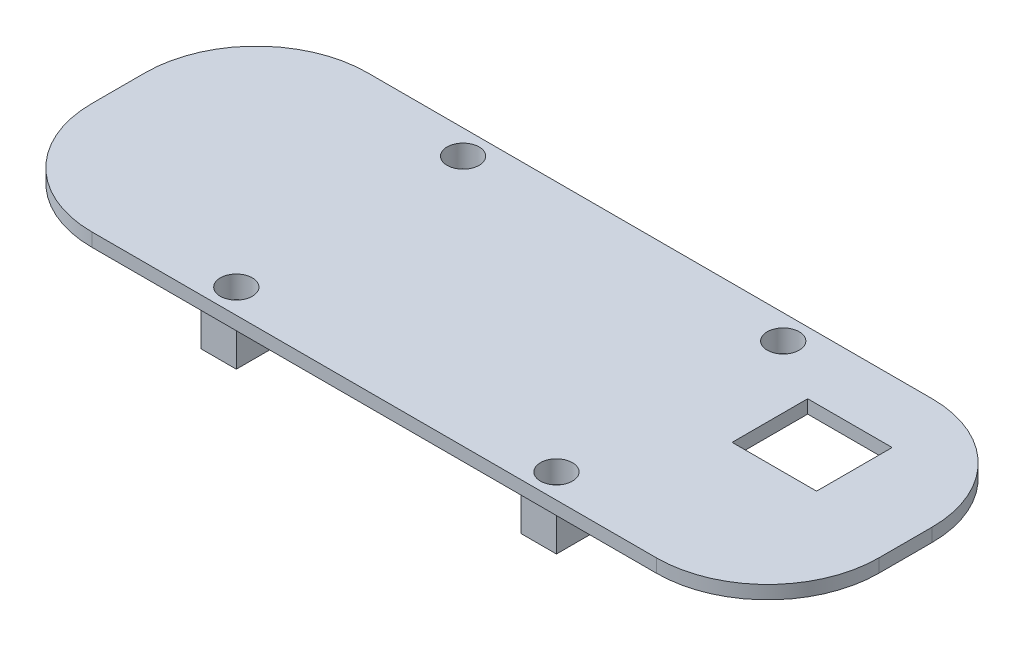
from build123d import *

# Parameters (mm, degrees)
SKETCH1_W                = 177
SKETCH1_H                = 62
BOSS_EXTRUDE1_DEPTH      = 70
FILLET1_R                = 25
SKETCH3_W                = 19
SKETCH3_H                = 17
CUT_EXTRUDE1_DEPTH       = 70
CUT_EXTRUDE5_DEPTH       = 64
BOSS_EXTRUDE7_DEPTH      = 33
SKETCH16_W               = 5
SKETCH16_H               = 5
BOSS_EXTRUDE8_DEPTH      = 40
SKETCH11_R               = 25
CUT_EXTRUDE9_DEPTH       = 5.5
SKETCH22_R               = 28.5
BOSS_EXTRUDE20_DEPTH     = 21
BOSS_EXTRUDE21_DEPTH     = 10
BOSS_EXTRUDE22_DEPTH     = 40
SKETCH26_R               = 25
SKETCH26_W               = 19
SKETCH26_H               = 17
BOSS_EXTRUDE23_DEPTH     = 1
SKETCH27_W               = 40
SKETCH27_H               = 10
CUT_EXTRUDE12_DEPTH      = 10
SKETCH28_W               = 10
SKETCH28_H               = 10
CUT_EXTRUDE13_DEPTH      = 5
SKETCH30_W               = 194.337314874
SKETCH30_H               = 68.122542634
CUT_EXTRUDE14_DEPTH      = 0.1
CUT_EXTRUDE17_DEPTH      = 58
CUT_EXTRUDE17_DEPTH_BACK = 45
SKETCH26_3_R             = 25
SKETCH26_3_W             = 19
SKETCH26_3_H             = 17
CUT_EXTRUDE25_START      = -21.9
CUT_EXTRUDE25_DEPTH      = 21.9
SKETCH38_W               = 8
SKETCH38_H               = 8
BOSS_EXTRUDE26_DEPTH     = 12
SKETCH41_R               = 3.6
CUT_EXTRUDE28_DEPTH      = 5
SKETCH44_R               = 2.1
CUT_EXTRUDE29_DEPTH      = 8
CUT_EXTRUDE30_START      = -3
SKETCH22_2_R             = 28.5
CUT_EXTRUDE30_DEPTH      = 40
SKETCH45_W               = 19.955287375
SKETCH45_H               = 24.166036088
CUT_EXTRUDE31_DEPTH      = 112


with BuildPart() as part:
    # Sketch1 → Boss-Extrude1 (new body)
    with BuildSketch(Plane(origin=(0, 0, 0), x_dir=(1, 0, 0), z_dir=(0, 1, 0))):
        with Locations((88.5, 31)):
            Rectangle(SKETCH1_W, SKETCH1_H)
    extrude(amount=BOSS_EXTRUDE1_DEPTH)

    # Fillet1
    fillet1_edges = [part.edges().sort_by_distance(p)[0] for p in [
        (0, 35, -62),
        (177, 35, -62),
        (177, 35, 0),
        (0, 35, 0),
    ]]
    fillet(fillet1_edges, radius=FILLET1_R)

    # Sketch3 → Cut-Extrude1 (cut)
    with BuildSketch(Plane(origin=(0, 70, 0), x_dir=(1, 0, 0), z_dir=(0, 1, 0))):
        with Locations((147.5, 39.5)):
            Rectangle(SKETCH3_W, SKETCH3_H)
    extrude(amount=-CUT_EXTRUDE1_DEPTH, mode=Mode.SUBTRACT)

    # Sketch9 → Cut-Extrude5 (cut)
    with BuildSketch(Plane(origin=(0, 67, 0), x_dir=(1, 0, 0), z_dir=(0, 1, 0))):
        with BuildLine():
            Line((25, 59), (152, 59))
            ThreePointArc((152, 59), (167.556349186, 52.556349186), (174, 37))
            Line((174, 37), (174, 25))
            ThreePointArc((174, 25), (167.556349186, 9.443650814), (152, 3))
            Line((152, 3), (25, 3))
            ThreePointArc((25, 3), (9.443650814, 9.443650814), (3, 25))
            Line((3, 25), (3, 37))
            ThreePointArc((3, 37), (9.443650814, 52.556349186), (25, 59))
        make_face()
    extrude(amount=-CUT_EXTRUDE5_DEPTH, mode=Mode.SUBTRACT)

    # Sketch15 → Boss-Extrude7 (add)
    with BuildSketch(Plane.XZ):
        Polygon((125, -7), (121, -3), (119, -3), (119, -7.5), (125, -7.5), align=None)
        Polygon((137, -7), (137, -7.5), (143, -7.5), (143, -3), (141, -3), align=None)
    extrude(amount=-BOSS_EXTRUDE7_DEPTH)

    # Sketch16 → Boss-Extrude8 (add)
    with BuildSketch(Plane.XZ):
        with Locations((58.5, -5.5)):
            Rectangle(SKETCH16_W, SKETCH16_H)
        Polygon((61, -40.5), (61, -44), (101, -44), (101, -40.5), (106, -40.5), (106, -59), (56, -59), (56, -40.5), align=None)
        with Locations((104.5, -5.5)):
            Rectangle(SKETCH16_W, SKETCH16_H)
    extrude(amount=-BOSS_EXTRUDE8_DEPTH)

    # Sketch11 → Cut-Extrude9 (cut)
    with BuildSketch(Plane.XZ):
        with Locations(Location((31, -31, 0), (0, 0, 270))):
            Circle(SKETCH11_R)
    extrude(amount=-CUT_EXTRUDE9_DEPTH, mode=Mode.SUBTRACT)

    # Sketch22 → Boss-Extrude20 (add)
    with BuildSketch(Plane(origin=(0, 70, 0), x_dir=(1, 0, 0), z_dir=(0, 1, 0))):
        with Locations((31, 31)):
            Circle(SKETCH22_R)
    extrude(amount=-BOSS_EXTRUDE20_DEPTH)

    # Sketch24 → Boss-Extrude21 (add)
    with BuildSketch(Plane.XZ):
        Polygon((123.5, -7.5), (125, -7.5), (125, -29.5), (137, -29.5), (137, -7.5), (138.5, -7.5), (138.5, -35.5), (123.5, -35.5), align=None)
    extrude(amount=-BOSS_EXTRUDE21_DEPTH)

    # Sketch25 → Boss-Extrude22 (add)
    with BuildSketch(Plane.XZ):
        Polygon((134.5, -35.5), (134.5, -31.5), (124.5, -31.5), (124.5, -45.5), (128.5, -45.5), (128.5, -35.5), align=None)
        Polygon((160.5, -35.5), (166.5, -35.5), (166.5, -45.5), (170.5, -45.5), (170.5, -31.5), (160.5, -31.5), align=None)
    extrude(amount=-BOSS_EXTRUDE22_DEPTH)

    # Sketch26 → Boss-Extrude23 (add)
    with BuildSketch(Plane.XZ):
        with BuildLine():
            Line((25, 0), (152, 0))
            ThreePointArc((152, 0), (169.67766953, -7.32233047), (177, -25))
            Line((177, -25), (177, -37))
            ThreePointArc((177, -37), (169.67766953, -54.67766953), (152, -62))
            Line((152, -62), (25, -62))
            ThreePointArc((25, -62), (7.32233047, -54.67766953), (0, -37))
            Line((0, -37), (0, -25))
            ThreePointArc((0, -25), (7.32233047, -7.32233047), (25, 0))
        make_face()
        with Locations(Location((31, -31, 0), (0, 0, 270))):
            Circle(SKETCH26_R, mode=Mode.SUBTRACT)
        with Locations((147.5, -39.5)):
            Rectangle(SKETCH26_W, SKETCH26_H, mode=Mode.SUBTRACT)
    extrude(amount=BOSS_EXTRUDE23_DEPTH)

    # Sketch27 → Cut-Extrude12 (cut)
    with BuildSketch(Plane.ZY):
        with Locations((-31, 34.5)):
            Rectangle(SKETCH27_W, SKETCH27_H)
    extrude(amount=-CUT_EXTRUDE12_DEPTH, mode=Mode.SUBTRACT)

    # Sketch28 → Cut-Extrude13 (cut)
    with BuildSketch(Plane.XZ.offset(1)):
        with Locations((115, -54)):
            Rectangle(SKETCH28_W, SKETCH28_H)
    extrude(amount=-CUT_EXTRUDE13_DEPTH, mode=Mode.SUBTRACT)

    # Sketch30 → Cut-Extrude14 (cut)
    with BuildSketch(Plane(origin=(0, 67, 0), x_dir=(1, 0, 0), z_dir=(0, 1, 0))):
        with Locations((88.376869027, 31.076383763)):
            Rectangle(SKETCH30_W, SKETCH30_H)
        with BuildLine():
            Line((25, 58), (152, 58))
            ThreePointArc((152, 58), (166.849242405, 51.849242405), (173, 37))
            Line((173, 37), (173, 25))
            ThreePointArc((173, 25), (166.849242405, 10.150757595), (152, 4))
            Line((152, 4), (25, 4))
            ThreePointArc((25, 4), (10.150757595, 10.150757595), (4, 25))
            Line((4, 25), (4, 37))
            ThreePointArc((4, 37), (10.150757595, 51.849242405), (25, 58))
        make_face(mode=Mode.SUBTRACT)
    extrude(amount=-CUT_EXTRUDE14_DEPTH, mode=Mode.SUBTRACT)

    # Sketch26<3> → Cut-Extrude17 (cut, two sides: drawn at the far end of the back side and taken through both)
    with BuildSketch(Plane.XZ.offset(-CUT_EXTRUDE17_DEPTH_BACK)):
        with BuildLine():
            Line((25, 0), (152, 0))
            ThreePointArc((152, 0), (169.67766953, -7.32233047), (177, -25))
            Line((177, -25), (177, -37))
            ThreePointArc((177, -37), (169.67766953, -54.67766953), (152, -62))
            Line((152, -62), (25, -62))
            ThreePointArc((25, -62), (7.32233047, -54.67766953), (0, -37))
            Line((0, -37), (0, -25))
            ThreePointArc((0, -25), (7.32233047, -7.32233047), (25, 0))
        make_face()
        with Locations((31, -31)):
            Circle(SKETCH26_3_R, mode=Mode.SUBTRACT)
        with Locations((147.5, -39.5)):
            Rectangle(SKETCH26_3_W, SKETCH26_3_H, mode=Mode.SUBTRACT)
    extrude(amount=CUT_EXTRUDE17_DEPTH + CUT_EXTRUDE17_DEPTH_BACK, mode=Mode.SUBTRACT)


with BuildPart() as cut_extrude17_piece_1:
    # of the separate pieces the step leaves, piece 1, a body of its own (cut_extrude17_pieces)
    add(part.part.solids().sort_by_distance((25, 70, 0))[0])

    # Sketch36 → Cut-Extrude25 (cut)
    with BuildSketch(Plane.XZ.offset(-45).offset(CUT_EXTRUDE25_START)):
        with BuildLine():
            Line((152, 0), (25, 0))
            ThreePointArc((25, 0), (7.32233047, -7.32233047), (0, -25))
            Line((0, -25), (0, -37))
            ThreePointArc((0, -37), (7.32233047, -54.67766953), (25, -62))
            Line((25, -62), (152, -62))
            ThreePointArc((152, -62), (169.67766953, -54.67766953), (177, -37))
            Line((177, -37), (177, -25))
            ThreePointArc((177, -25), (169.67766953, -7.32233047), (152, 0))
        make_face()
        with BuildLine():
            ThreePointArc((3, -25), (9.443650814, -9.443650814), (25, -3))
            Line((25, -3), (152, -3))
            ThreePointArc((152, -3), (167.556349186, -9.443650814), (174, -25))
            Line((174, -25), (174, -37))
            ThreePointArc((174, -37), (167.556349186, -52.556349186), (152, -59))
            Line((152, -59), (25.684927094, -59))
            ThreePointArc((25.684927094, -59), (9.884563828, -52.596687732), (3, -37))
            Line((3, -37), (3, -25))
        make_face(mode=Mode.SUBTRACT)
    extrude(amount=CUT_EXTRUDE25_DEPTH, mode=Mode.SUBTRACT)

    # Sketch38 → Boss-Extrude26 (add)
    with BuildSketch(Plane(origin=(0, 70, 0), x_dir=(1, 0, 0), z_dir=(0, 1, 0))):
        with Locations((52, 56.5)):
            Rectangle(SKETCH38_W, SKETCH38_H)
        with Locations((124, 56.5)):
            Rectangle(SKETCH38_W, SKETCH38_H)
        with Locations((52, 5.5)):
            Rectangle(SKETCH38_W, SKETCH38_H)
        with Locations((124, 5.5)):
            Rectangle(SKETCH38_W, SKETCH38_H)
    extrude(amount=-BOSS_EXTRUDE26_DEPTH)

    # Sketch41 → Cut-Extrude28 (cut)
    with BuildSketch(Plane(origin=(0, 70, 0), x_dir=(1, 0, 0), z_dir=(0, 1, 0))):
        with Locations(Location((52, 56.5, 0), (0, 0, 270))):
            Circle(SKETCH41_R)
        with Locations(Location((124, 56.5, 0), (0, 0, 270))):
            Circle(SKETCH41_R)
        with Locations(Location((52, 5.5, 0), (0, 0, 270))):
            Circle(SKETCH41_R)
        with Locations(Location((124, 5.5, 0), (0, 0, 270))):
            Circle(SKETCH41_R)
    extrude(amount=-CUT_EXTRUDE28_DEPTH, mode=Mode.SUBTRACT)

    # Sketch44 → Cut-Extrude29 (cut)
    with BuildSketch(Plane.XZ.offset(-58)):
        with Locations(Location((52, -5.5, 0), (0, 0, 270))):
            Circle(SKETCH44_R)
        with Locations(Location((124, -56.5, 0), (0, 0, 270))):
            Circle(SKETCH44_R)
        with Locations(Location((52, -56.5, 0), (0, 0, 270))):
            Circle(SKETCH44_R)
        with Locations(Location((124, -5.5, 0), (0, 0, 270))):
            Circle(SKETCH44_R)
    extrude(amount=-CUT_EXTRUDE29_DEPTH, mode=Mode.SUBTRACT)

    # Sketch22<2> → Cut-Extrude30 (cut)
    with BuildSketch(Plane(origin=(0, 70, 0), x_dir=(1, 0, 0), z_dir=(0, 1, 0)).offset(CUT_EXTRUDE30_START)):
        with Locations((31, 31)):
            Circle(SKETCH22_2_R)
    extrude(amount=-CUT_EXTRUDE30_DEPTH, mode=Mode.SUBTRACT)


with BuildPart() as cut_extrude17_piece_2:
    # of the separate pieces the step leaves, piece 2, a body of its own (cut_extrude17_pieces)
    add(part.part.solids().sort_by_distance((138.5, 0, -35.5))[0])

    # Sketch45 → Cut-Extrude31 (cut)
    with BuildSketch(Plane.XZ.offset(-67)):
        with Locations((142.415891121, -34.661520619)):
            Rectangle(SKETCH45_W, SKETCH45_H)
    extrude(amount=CUT_EXTRUDE31_DEPTH, mode=Mode.SUBTRACT)


solid = cut_extrude17_piece_1.part
